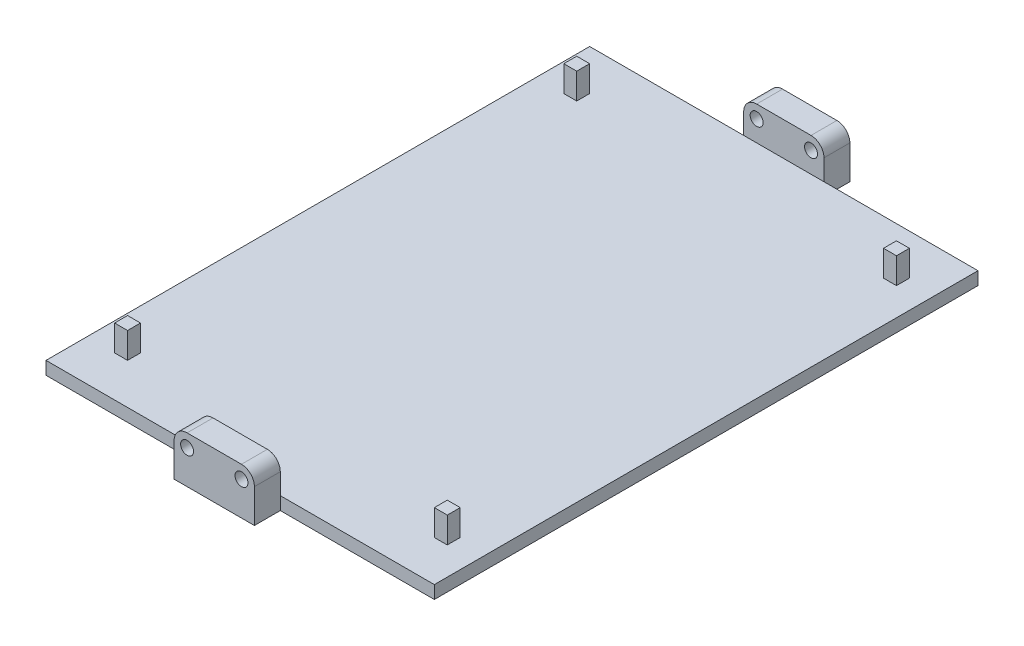
from build123d import *

# Parameters (mm, degrees)
SKETCH1_W           = 60
SKETCH1_H           = 84
BOSS_EXTRUDE1_DEPTH = 2
SKETCH4_W           = 2
SKETCH4_H           = 2
BOSS_EXTRUDE3_DEPTH = 4
SKETCH5_W           = 12.4
SKETCH5_H           = 2
SKETCH5_R           = 2
SKETCH5_R_2         = 1
BOSS_EXTRUDE4_DEPTH = 4


with BuildPart() as part:
    # Sketch1 → Boss-Extrude1 (new body)
    with BuildSketch(Plane(origin=(0, 0, 0), x_dir=(1, 0, 0), z_dir=(0, 1, 0))):
        Rectangle(SKETCH1_W, SKETCH1_H)
    extrude(amount=BOSS_EXTRUDE1_DEPTH)

    # Sketch4 → Boss-Extrude3 (add)
    with BuildSketch(Plane(origin=(0, 2, 0), x_dir=(1, 0, 0), z_dir=(0, 1, 0))):
        with Locations((-24.7, 34.7)):
            Rectangle(SKETCH4_W, SKETCH4_H)
        with Locations((24.7, 34.7)):
            Rectangle(SKETCH4_W, SKETCH4_H)
        with Locations((24.7, -34.7)):
            Rectangle(SKETCH4_W, SKETCH4_H)
        with Locations((-24.7, -34.7)):
            Rectangle(SKETCH4_W, SKETCH4_H)
    extrude(amount=BOSS_EXTRUDE3_DEPTH)

    # Sketch5 → Boss-Extrude4 (add)
    # profile 1 of 4: a face of its own
    with BuildSketch(Plane(origin=(0, 0, -42), x_dir=(-1, 0, 0), z_dir=(0, 0, -1))):
        with Locations((0, 1)):
            Rectangle(SKETCH5_W, SKETCH5_H)
    # profile 2 of 4: a face of its own
    with BuildSketch(Plane(origin=(0, 0, -42), x_dir=(-1, 0, 0), z_dir=(0, 0, -1))):
        with BuildLine():
            ThreePointArc((-2.2, 5.2), (-4.2, 3.2), (-6.2, 5.2))
            Line((-6.2, 5.2), (-6.2, 2))
            Line((-6.2, 2), (6.2, 2))
            Line((6.2, 2), (6.2, 5.2))
            ThreePointArc((6.2, 5.2), (2.785786438, 3.785786438), (4.2, 7.2))
            Line((4.2, 7.2), (-4.2, 7.2))
            ThreePointArc((-4.2, 7.2), (-2.785786438, 6.614213562), (-2.2, 5.2))
        make_face()
    # profile 3 of 4: a face of its own
    with BuildSketch(Plane(origin=(0, 0, -42), x_dir=(-1, 0, 0), z_dir=(0, 0, -1))):
        with Locations((-4.2, 5.2)):
            Circle(SKETCH5_R)
        with Locations((-4.2, 5.2)):
            Circle(SKETCH5_R_2, mode=Mode.SUBTRACT)
    # profile 4 of 4: a face of its own
    with BuildSketch(Plane(origin=(0, 0, -42), x_dir=(-1, 0, 0), z_dir=(0, 0, -1))):
        with Locations((4.2, 5.2)):
            Circle(SKETCH5_R)
        with Locations((4.2, 5.2)):
            Circle(SKETCH5_R_2, mode=Mode.SUBTRACT)
    boss_extrude4 = extrude(amount=BOSS_EXTRUDE4_DEPTH)

    # Mirror1: Boss-Extrude4 across plane
    add(boss_extrude4.mirror(Plane.XY))


solid = part.part
